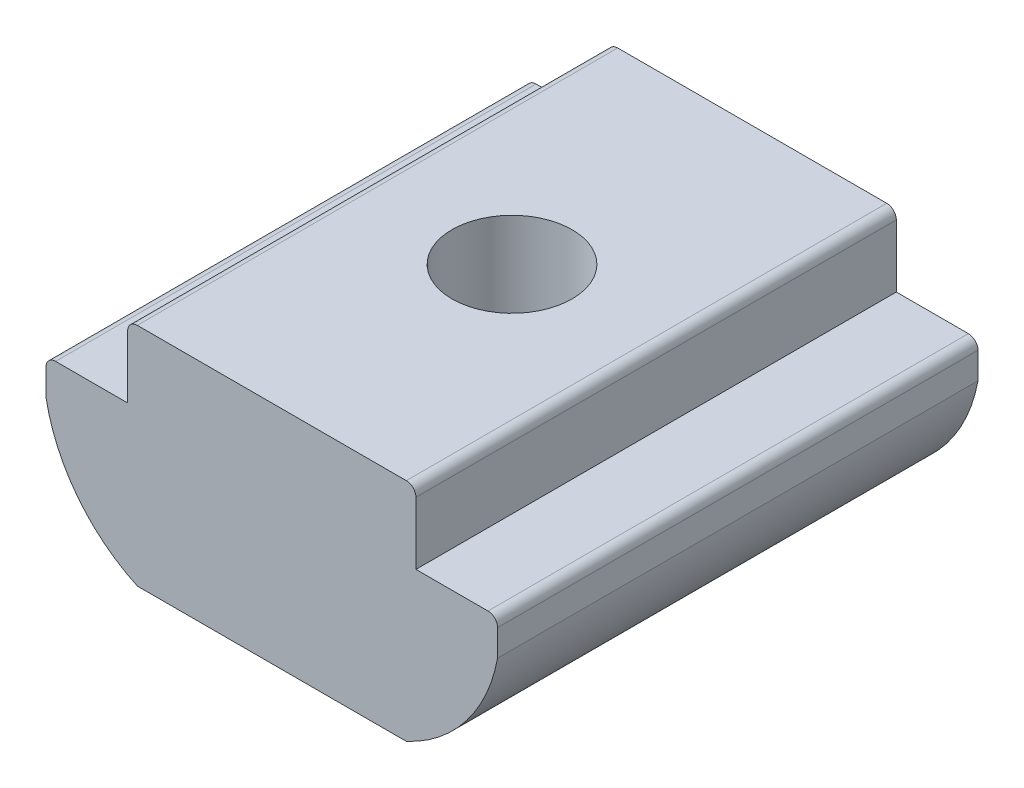
from build123d import *

# Parameters (mm, degrees)
EXTRUDE_1_DEPTH      = 5
HOLE_WIZARD_M3_D     = 2.5
HOLE_WIZARD_M3_DEPTH = 7.5
HOLE_WIZARD_M3_TIP   = 0.751075774


with BuildPart() as part:
    # 草图1 → 凸台-拉伸1 (new, symmetric)
    with BuildSketch(Plane.XY):
        with BuildLine():
            Line((-2.8, 4.7), (2.8, 4.7))
            ThreePointArc((2.8, 4.7), (2.941421356, 4.641421356), (3, 4.5))
            Line((3, 4.5), (3, 3.2))
            Line((3, 3.2), (4.5, 3.2))
            ThreePointArc((4.5, 3.2), (4.641421356, 3.141421356), (4.7, 3))
            Line((4.7, 3), (4.7, 2.45))
            ThreePointArc((4.7, 2.45), (4.047583818, 0.994220712), (2.8, 0))
            Line((2.8, 0), (-2.8, 0))
            ThreePointArc((-2.8, 0), (-4.047583818, 0.994220712), (-4.7, 2.45))
            Line((-4.7, 2.45), (-4.7, 3))
            ThreePointArc((-4.7, 3), (-4.641421356, 3.141421356), (-4.5, 3.2))
            Line((-4.5, 3.2), (-3, 3.2))
            Line((-3, 3.2), (-3, 4.5))
            ThreePointArc((-3, 4.5), (-2.941421356, 4.641421356), (-2.8, 4.7))
        make_face()
    extrude(amount=EXTRUDE_1_DEPTH, both=True)

    # M3螺纹孔
    with Locations(Plane.ZX.offset(4.7)):
        with Locations((0, 0)):
            Hole(HOLE_WIZARD_M3_D / 2, depth=HOLE_WIZARD_M3_DEPTH)
            with Locations((0, 0, -(HOLE_WIZARD_M3_DEPTH + HOLE_WIZARD_M3_TIP / 2))):  # 118° drill point
                Cone(0, HOLE_WIZARD_M3_D / 2, HOLE_WIZARD_M3_TIP, mode=Mode.SUBTRACT)


solid = part.part
